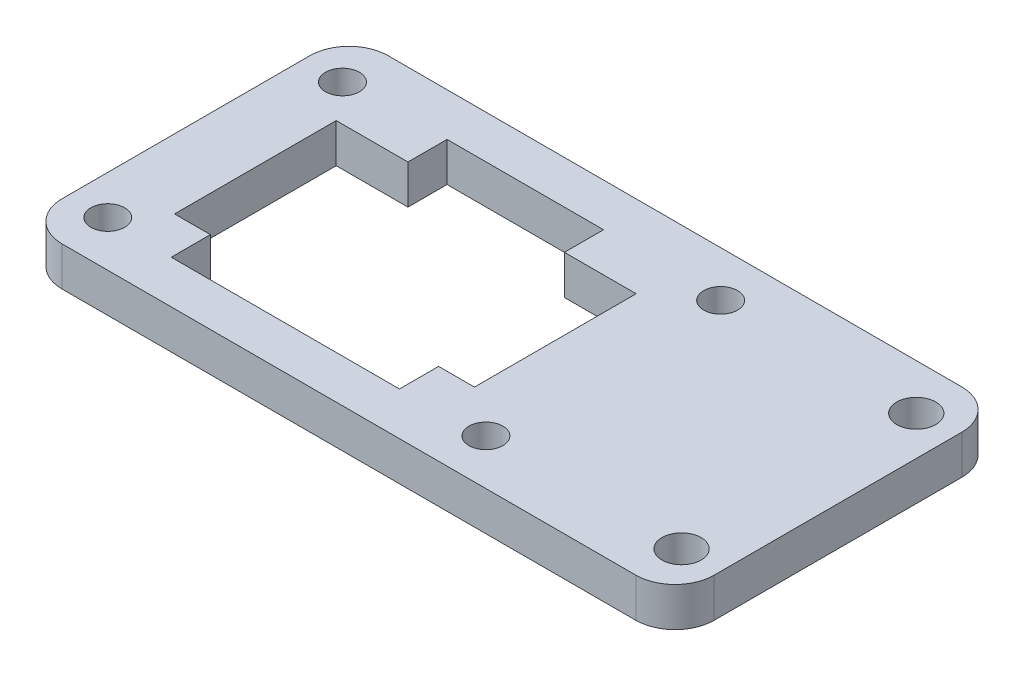
from build123d import *

# Parameters (mm, degrees)
PERFIL_PRINCIPAL_W           = 50
PERFIL_PRINCIPAL_H           = 25
BASE_DEPTH                   = 3
PERFIL_CORTE_W               = 23
PERFIL_CORTE_H               = 12.4
CORTE_PRINCIPAL_DEPTH        = 82.921801368
ESBO_O7_W                    = 12
ESBO_O7_H                    = 3
ESBO_O7_W_2                  = 17.5
CORTE_EXTRUS_O3_DEPTH        = 91.332942436
FURO_DE_DI_METRO_3_0_3_1_D   = 3
FURO_DE_DI_METRO_2_6_2_6_1_D = 2.6
FILETE1_R                    = 3


with BuildPart() as part:
    # Perfil Principal → Base (new body)
    with BuildSketch(Plane(origin=(0, 0, 0), x_dir=(1, 0, 0), z_dir=(0, 1, 0))):
        Rectangle(PERFIL_PRINCIPAL_W, PERFIL_PRINCIPAL_H)
    extrude(amount=BASE_DEPTH)

    # Perfil Corte → Corte Principal (cut, through all)
    with BuildSketch(Plane(origin=(49.188016516, 0, 22.11675526), x_dir=(-1, 0, 0), z_dir=(0, -1, 0))):
        with Locations((57.368016516, 22.11675526)):
            Rectangle(PERFIL_CORTE_W, PERFIL_CORTE_H)
    extrude(amount=-CORTE_PRINCIPAL_DEPTH, mode=Mode.SUBTRACT)

    # Esboço7 → Corte-extrusão3 (cut, through all)
    with BuildSketch(Plane(origin=(56.452995871, 0, 26.44162237), x_dir=(-1, 0, 0), z_dir=(0, -1, 0))):
        with Locations((64.632995871, 34.14162237)):
            Rectangle(ESBO_O7_W, ESBO_O7_H)
        with Locations((64.632995871, 18.74162237)):
            Rectangle(ESBO_O7_W_2, ESBO_O7_H)
    extrude(amount=-CORTE_EXTRUS_O3_DEPTH, mode=Mode.SUBTRACT)

    # Furo de diâmetro Ø3.0 (3)1 (through all)
    with Locations(Plane(origin=(0, 3, 0), x_dir=(1, 0, 0), z_dir=(0, 1, 0))):
        with Locations((22, 9), (22, -9)):
            Hole(FURO_DE_DI_METRO_3_0_3_1_D / 2)

    # Furo de diâmetro Ø2.6 (2.6)1 (through all)
    with Locations(Plane(origin=(0, 3, 0), x_dir=(1, 0, 0), z_dir=(0, 1, 0))):
        with Locations((-22, 9), (-22, -9), (7, 9), (7, -9)):
            Hole(FURO_DE_DI_METRO_2_6_2_6_1_D / 2)

    # Filete1
    filete1_edges = [part.edges().sort_by_distance(p)[0] for p in [
        (-25, 1.5, 12.5),
        (-25, 1.5, -12.5),
        (25, 1.5, -12.5),
        (25, 1.5, 12.5),
    ]]
    fillet(filete1_edges, radius=FILETE1_R)


solid = part.part
